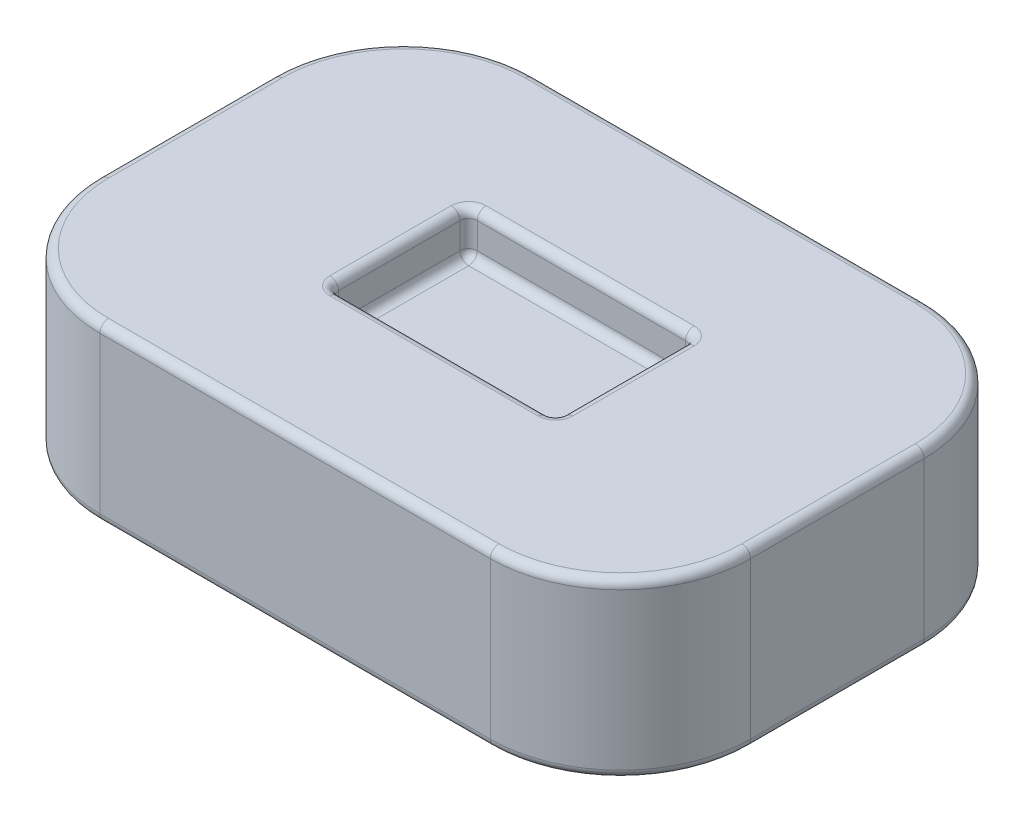
from build123d import *

# Parameters (mm, degrees)
SKETCH1_W           = 15
SKETCH1_H           = 10
BOSS_EXTRUDE1_DEPTH = 4
SKETCH2_W           = 5.2
SKETCH2_H           = 3.2
CUT_EXTRUDE1_DEPTH  = 1
FILLET1_R           = 3
FILLET2_R           = 0.2


with BuildPart() as part:
    # Sketch1 → Boss-Extrude1 (new body)
    with BuildSketch(Plane(origin=(0, 0, 0), x_dir=(1, 0, 0), z_dir=(0, 1, 0))):
        Rectangle(SKETCH1_W, SKETCH1_H)
    extrude(amount=BOSS_EXTRUDE1_DEPTH)

    # Sketch2 → Cut-Extrude1 (cut)
    with BuildSketch(Plane(origin=(0, 4, 0), x_dir=(1, 0, 0), z_dir=(0, 1, 0))):
        Rectangle(SKETCH2_W, SKETCH2_H)
    extrude(amount=-CUT_EXTRUDE1_DEPTH, mode=Mode.SUBTRACT)

    # Fillet1
    fillet1_edges = [part.edges().sort_by_distance(p)[0] for p in [
        (7.5, 2, 5),
        (-7.5, 2, 5),
        (-7.5, 2, -5),
        (7.5, 2, -5),
    ]]
    fillet(fillet1_edges, radius=FILLET1_R)

    # Fillet2
    fillet2_edges = [part.edges().sort_by_distance(p)[0] for p in [
        (2.6, 3, 0),
        (2.6, 3.5, -1.6),
        (0, 3, 1.6),
        (2.6, 3.5, 1.6),
        (-2.6, 3, 0),
        (-2.6, 3.5, 1.6),
        (0, 3, -1.6),
        (-2.6, 3.5, -1.6),
        (2.6, 4, 0),
        (0, 4, -1.6),
        (-2.6, 4, 0),
        (0, 4, 1.6),
        (-7.5, 0, 0),
        (-7.5, 4, 0),
        (7.5, 0, 0),
        (0, 0, 5),
        (0, 0, -5),
        (6.621320344, 0, 4.121320344),
        (-6.621320344, 0, 4.121320344),
        (6.621320344, 0, -4.121320344),
        (-6.621320344, 0, -4.121320344),
        (0, 4, -5),
        (7.5, 4, 0),
        (0, 4, 5),
        (6.621320344, 4, 4.121320344),
        (-6.621320344, 4, 4.121320344),
        (6.621320344, 4, -4.121320344),
        (-6.621320344, 4, -4.121320344),
    ]]
    fillet(fillet2_edges, radius=FILLET2_R)


solid = part.part
